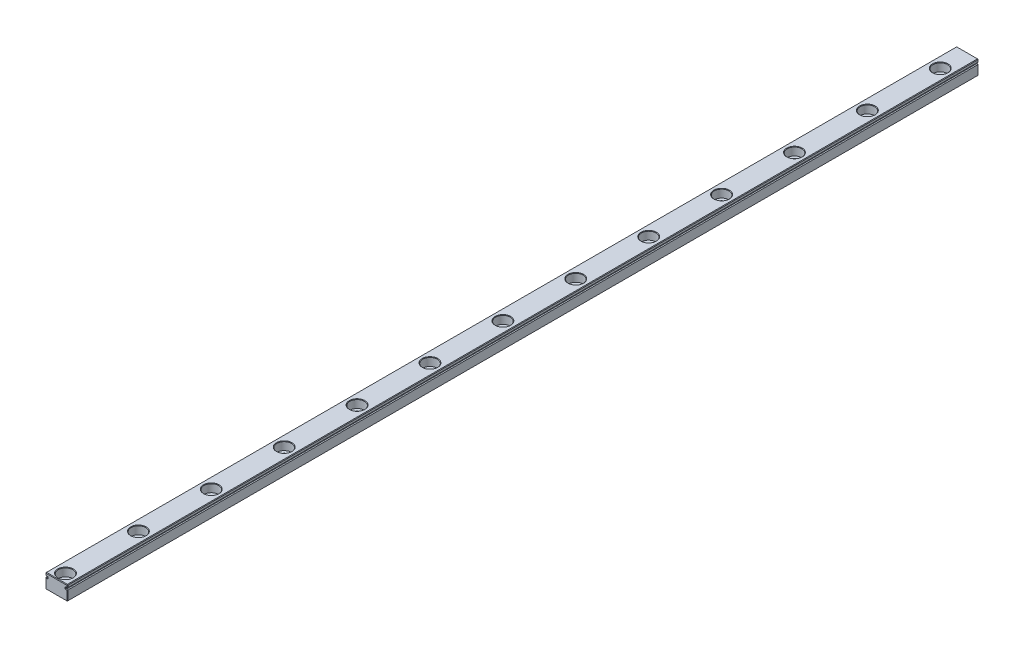
from build123d import *

# Parameters (mm, degrees)
BOSS_EXTRUDE1_DEPTH = 500
CHAMFER1_SIZE       = 0.3
LPATTERN1_COUNT     = 13
LPATTERN1_PITCH     = 40


with BuildPart() as part:
    # Sketch1 → Boss-Extrude1 (new body)
    with BuildSketch(Plane.XY):
        with BuildLine():
            Line((0, 8), (12, 8))
            Line((12, 8), (12, 6.75))
            Line((12, 6.75), (12, 6.559016994))
            ThreePointArc((12, 6.559016994), (11.706107374, 6.475528258), (11.5, 6.25))
            Line((11.5, 6.25), (11, 6.25))
            Line((11, 6.25), (11, 5.75))
            Line((11, 5.75), (11.5, 5.75))
            ThreePointArc((11.5, 5.75), (11.706107374, 5.524471742), (12, 5.440983006))
            Line((12, 5.440983006), (12, 5.25))
            Line((12, 5.25), (12, 0))
            Line((12, 0), (0, 0))
            Line((0, 0), (0, 5.25))
            Line((0, 5.25), (0, 5.440983006))
            ThreePointArc((0, 5.440983006), (0.293892626, 5.524471742), (0.5, 5.75))
            Line((0.5, 5.75), (1, 5.75))
            Line((1, 5.75), (1, 6.25))
            Line((1, 6.25), (0.5, 6.25))
            ThreePointArc((0.5, 6.25), (0.293892626, 6.475528258), (0, 6.559016994))
            Line((0, 6.559016994), (0, 6.75))
            Line((0, 6.75), (0, 8))
        make_face()
    extrude(amount=BOSS_EXTRUDE1_DEPTH)

    # Chamfer1
    chamfer1_edges = [part.edges().sort_by_distance(p)[0] for p in [
        (12, 2.720491503, 500),
        (11.706107374, 5.524471742, 500),
        (0, 2.720491503, 0),
        (0.293892626, 5.524471742, 0),
        (0.75, 5.75, 0),
        (1, 6, 0),
        (0.75, 6.25, 0),
        (11.25, 5.75, 500),
        (0.293892626, 6.475528258, 0),
        (0, 7.279508497, 0),
        (6, 8, 0),
        (12, 7.279508497, 0),
        (11.706107374, 6.475528258, 0),
        (11, 6, 500),
        (11.25, 6.25, 0),
        (11, 6, 0),
        (11.25, 5.75, 0),
        (11.706107374, 5.524471742, 0),
        (12, 2.720491503, 0),
        (6, 0, 0),
        (11.25, 6.25, 500),
        (11.706107374, 6.475528258, 500),
        (12, 7.279508497, 500),
        (0, 8, 250),
        (12, 8, 250),
        (12, 0, 250),
        (0, 0, 250),
        (6, 8, 500),
        (0, 2.720491503, 500),
        (0, 7.279508497, 500),
        (0.293892626, 6.475528258, 500),
        (0.75, 6.25, 500),
        (1, 6, 500),
        (0.75, 5.75, 500),
        (0.293892626, 5.524471742, 500),
        (6, 0, 500),
    ]]
    chamfer(chamfer1_edges, length=CHAMFER1_SIZE)

    # Sketch3 → CBORE for M5 Hex Head Bolt1 (revolve, cut)
    with BuildSketch(Plane(origin=(6, 8, 15), x_dir=(0, 0, 1), z_dir=(1, 0, 0))):
        Polygon((0, 0), (0, 8), (2.5, 8), (2.25, 7.75), (2.25, 4.5), (4, 4.5), (4, 0.25), (4.25, 0), align=None)
    cbore_for_m5_hex_head_bolt1 = revolve(axis=Axis((6, 14.35, 15), (0, -1, 0)), mode=Mode.SUBTRACT)

    # LPattern1: CBORE for M5 Hex Head Bolt1 ×13
    with Locations(*[(0, 0, i * LPATTERN1_PITCH) for i in range(1, LPATTERN1_COUNT)]):
        add(cbore_for_m5_hex_head_bolt1, mode=Mode.SUBTRACT)


solid = part.part
